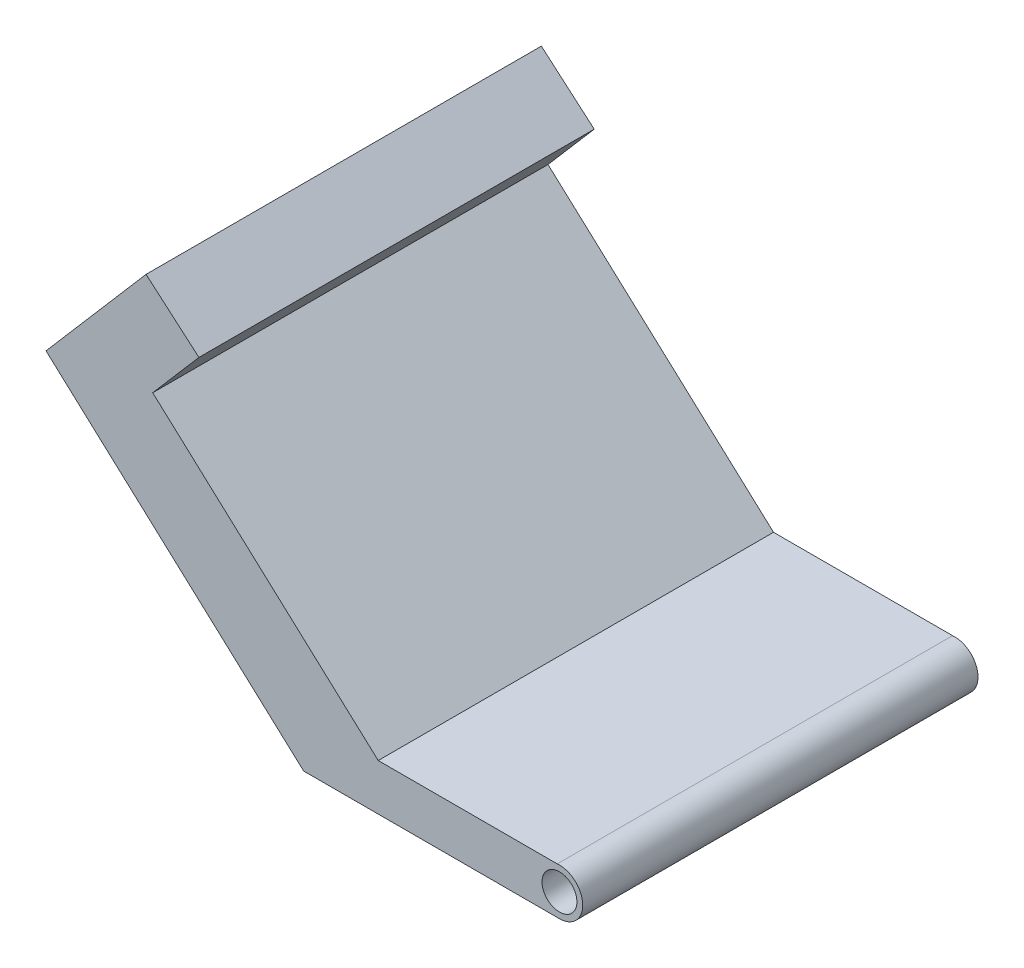
from build123d import *

# Parameters (mm, degrees)
SKETCH_1_R      = 7.5
EXTRUDE_1_DEPTH = 170


with BuildPart() as part:
    # 草图1 → 凸台-拉伸1 (new body)
    with BuildSketch(Plane.XY):
        with BuildLine():
            Line((0, -10), (-110, -10))
            Line((-110, -10), (-220.810216861, 91.099435405))
            Line((-220.810216861, 91.099435405), (-177.785501138, 141.099435405))
            Line((-177.785501138, 141.099435405), (-155.045503197, 121.531796466))
            Line((-155.045503197, 121.531796466), (-174.921114521, 98.433896817))
            Line((-174.921114521, 98.433896817), (-77.942720008, 9.954140983))
            Line((-77.942720008, 9.954140983), (-0.956596724, 9.954140983))
            ThreePointArc((-0.956596724, 9.954140983), (9.988528666, 0.478847664), (0, -10))
        make_face()
        Circle(SKETCH_1_R, mode=Mode.SUBTRACT)
    extrude(amount=EXTRUDE_1_DEPTH)


solid = part.part
